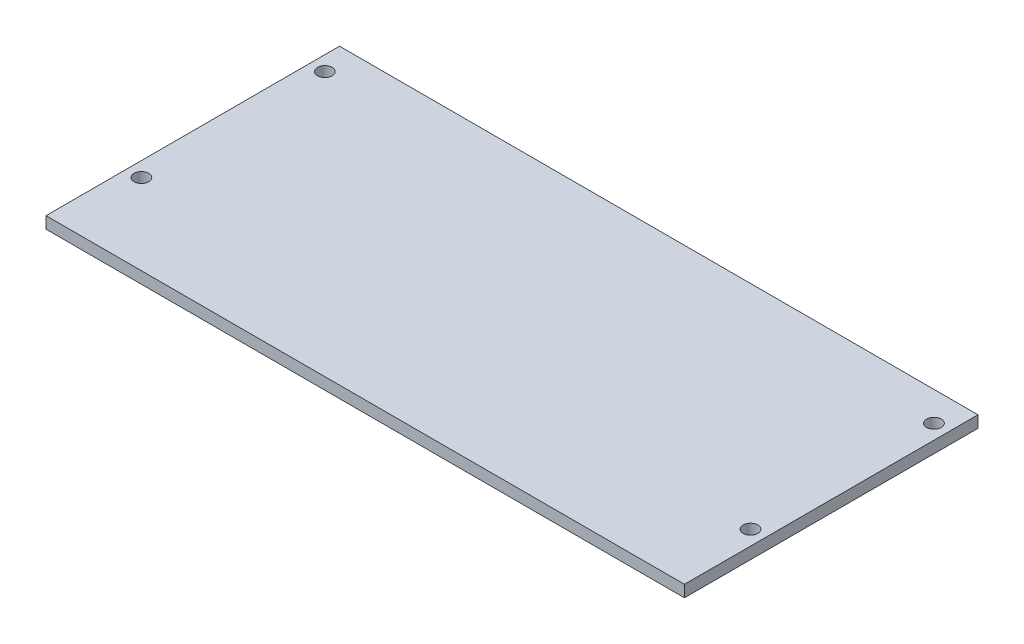
from build123d import *

# Parameters (mm, degrees)
SKETCH1_W           = 87
SKETCH1_H           = 40
BOSS_EXTRUDE1_DEPTH = 1.6
SKETCH2_R           = 1
CUT_EXTRUDE1_DEPTH  = 96.768261966


with BuildPart() as part:
    # Sketch1 → Boss-Extrude1 (new body)
    with BuildSketch(Plane(origin=(0, 0, 0), x_dir=(1, 0, 0), z_dir=(0, 1, 0))):
        with Locations((43.5, 20)):
            Rectangle(SKETCH1_W, SKETCH1_H)
    extrude(amount=BOSS_EXTRUDE1_DEPTH)

    # Sketch2 → Cut-Extrude1 (cut, through all)
    with BuildSketch(Plane(origin=(0, 1.6, 0), x_dir=(1, 0, 0), z_dir=(0, 1, 0))):
        with Locations(Location((2, 11, 0), (0, 0, 270))):
            Circle(SKETCH2_R)
        with Locations(Location((2, 36, 0), (0, 0, 270))):
            Circle(SKETCH2_R)
        with Locations(Location((85, 36, 0), (0, 0, 270))):
            Circle(SKETCH2_R)
        with Locations(Location((85, 11, 0), (0, 0, 270))):
            Circle(SKETCH2_R)
    extrude(amount=-CUT_EXTRUDE1_DEPTH, mode=Mode.SUBTRACT)


solid = part.part
